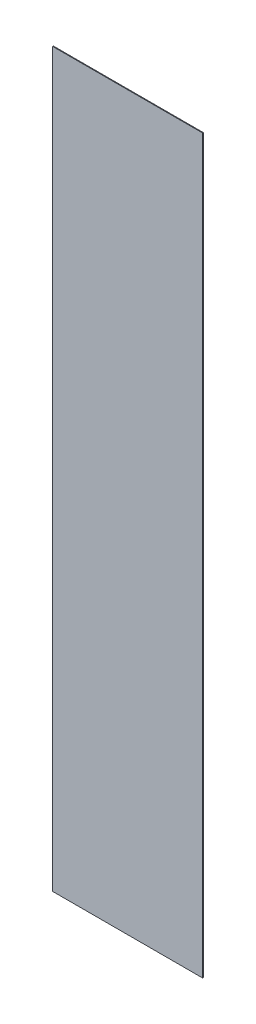
from build123d import *

# Parameters (mm, degrees)
SKETCH_1_W      = 420
SKETCH_1_H      = 2050
EXTRUDE_1_DEPTH = 2


with BuildPart() as part:
    # Эскиз1 → Бобышка-Вытянуть1 (new body)
    with BuildSketch(Plane.XY):
        with Locations((210, 1025)):
            Rectangle(SKETCH_1_W, SKETCH_1_H)
    extrude(amount=EXTRUDE_1_DEPTH)


solid = part.part
